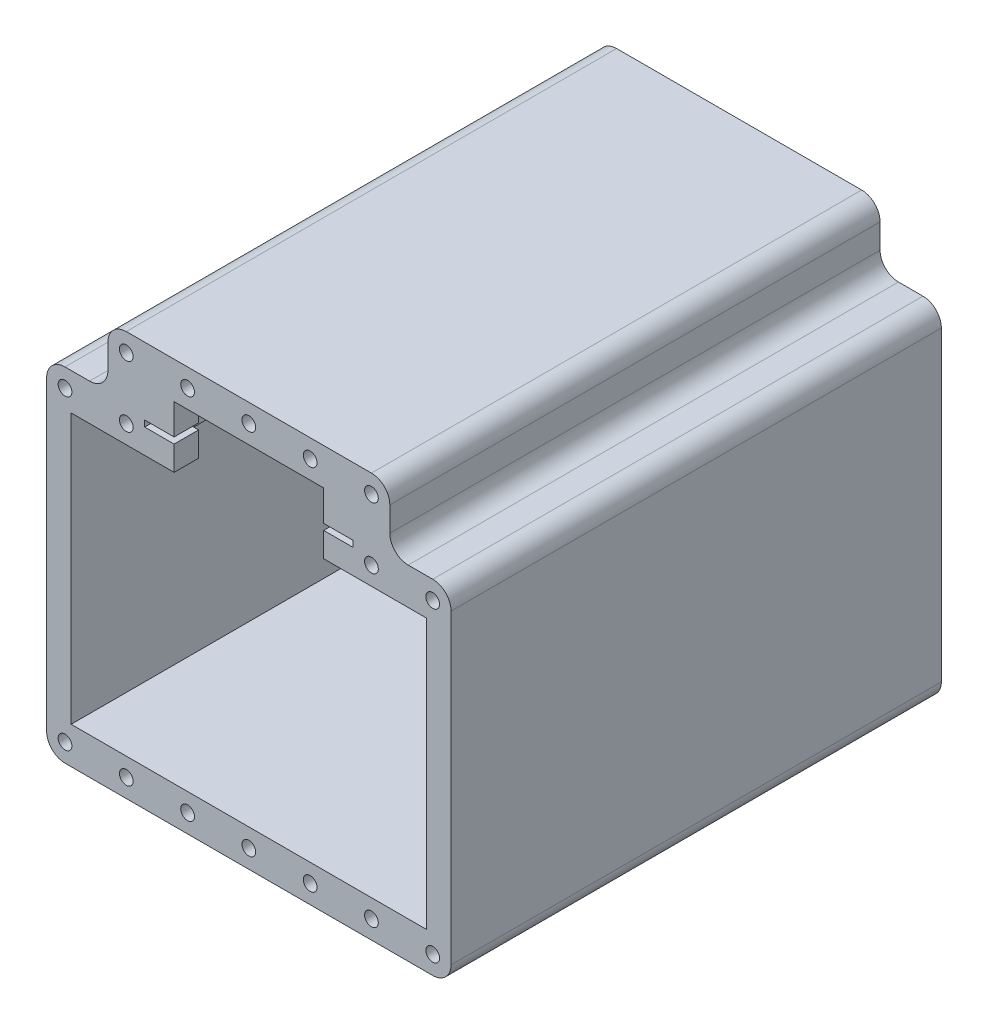
from build123d import *

# Parameters (mm, degrees)
BOSS_EXTRUDE1_DEPTH     = 200
CUT_EXTRUDE1_DEPTH      = 238.302549502
CUT_EXTRUDE1_DEPTH_BACK = 238.302549502
SKETCH2_R               = 2.8
SKETCH3_W               = 25
SKETCH3_H               = 200
BOSS_EXTRUDE2_DEPTH     = 25
SKETCH4_W               = 200
SKETCH4_H               = 2.5
CUT_EXTRUDE2_DEPTH      = 25
SKETCH5_W               = 200
SKETCH5_H               = 2.5
CUT_EXTRUDE3_DEPTH      = 25
CUT_EXTRUDE5_REACH      = 265.261
CUT_EXTRUDE7_REACH      = 251.862
SKETCH10_W              = 85
SKETCH10_H              = 35
SKETCH11_W              = 25
SKETCH11_H              = 15
BOSS_EXTRUDE3_DEPTH     = 25
CUT_EXTRUDE8_REACH      = 251.862
SKETCH12_W              = 85
SKETCH12_H              = 7.75


with BuildPart() as part:
    # Sketch1 → Boss-Extrude1 (new body)
    with BuildSketch(Plane.XY):
        with BuildLine():
            Line((-57.5, 60), (-57.5, 50))
            ThreePointArc((-57.5, 50), (-59.696699141, 44.696699141), (-65, 42.5))
            Line((-65, 42.5), (-75, 42.5))
            ThreePointArc((-75, 42.5), (-80.303300859, 40.303300859), (-82.5, 35))
            Line((-82.5, 35), (-82.5, -90))
            ThreePointArc((-82.5, -90), (-80.303300859, -95.303300859), (-75, -97.5))
            Line((-75, -97.5), (75, -97.5))
            ThreePointArc((75, -97.5), (80.303300859, -95.303300859), (82.5, -90))
            Line((82.5, -90), (82.5, 35))
            ThreePointArc((82.5, 35), (80.303300859, 40.303300859), (75, 42.5))
            Line((75, 42.5), (65, 42.5))
            ThreePointArc((65, 42.5), (59.696699141, 44.696699141), (57.5, 50))
            Line((57.5, 50), (57.5, 60))
            ThreePointArc((57.5, 60), (55.303300859, 65.303300859), (50, 67.5))
            Line((50, 67.5), (-50, 67.5))
            ThreePointArc((-50, 67.5), (-55.303300859, 65.303300859), (-57.5, 60))
        make_face()
        Polygon((-42.5, 52.5), (-42.5, 27.5), (-72.5, 27.5), (-72.5, -82.5), (72.5, -82.5), (72.5, 27.5), (42.5, 27.5), (42.5, 52.5), align=None, mode=Mode.SUBTRACT)
    extrude(amount=-BOSS_EXTRUDE1_DEPTH)

    # Sketch2 → Cut-Extrude1 (cut, two sides: drawn at the far end of the back side and taken through both)
    with BuildSketch(Plane.XY.offset(-CUT_EXTRUDE1_DEPTH_BACK)):
        with Locations((-75, 35)):
            Circle(SKETCH2_R)
        with Locations((-50, 35)):
            Circle(SKETCH2_R)
        with Locations((-50, 60)):
            Circle(SKETCH2_R)
        with Locations((50, 60)):
            Circle(SKETCH2_R)
        with Locations((25, 60)):
            Circle(SKETCH2_R)
        with Locations((0, 60)):
            Circle(SKETCH2_R)
        with Locations((-25, 60)):
            Circle(SKETCH2_R)
        with Locations((50, 35)):
            Circle(SKETCH2_R)
        with Locations((75, 35)):
            Circle(SKETCH2_R)
        with Locations((-75, -90)):
            Circle(SKETCH2_R)
        with Locations((-50, -90)):
            Circle(SKETCH2_R)
        with Locations((-25, -90)):
            Circle(SKETCH2_R)
        with Locations((0, -90)):
            Circle(SKETCH2_R)
        with Locations((25, -90)):
            Circle(SKETCH2_R)
        with Locations((50, -90)):
            Circle(SKETCH2_R)
        with Locations((75, -90)):
            Circle(SKETCH2_R)
    extrude(amount=CUT_EXTRUDE1_DEPTH + CUT_EXTRUDE1_DEPTH_BACK, mode=Mode.SUBTRACT)

    # Sketch3 → Boss-Extrude2 (add)
    with BuildSketch(Plane.XZ.offset(-52.5)):
        with Locations((-30, -100)):
            Rectangle(SKETCH3_W, SKETCH3_H)
        with Locations((30, -100)):
            Rectangle(SKETCH3_W, SKETCH3_H)
    extrude(amount=BOSS_EXTRUDE2_DEPTH)

    # Sketch4 → Cut-Extrude2 (cut)
    with BuildSketch(Plane(origin=(-17.5, 0, 0), x_dir=(0, 0, -1), z_dir=(1, 0, 0))):
        with Locations((100, 38.75)):
            Rectangle(SKETCH4_W, SKETCH4_H)
    extrude(amount=-CUT_EXTRUDE2_DEPTH, mode=Mode.SUBTRACT)

    # Sketch5 → Cut-Extrude3 (cut)
    with BuildSketch(Plane.ZY.offset(-17.5)):
        with Locations((-100, 38.75)):
            Rectangle(SKETCH5_W, SKETCH5_H)
    extrude(amount=-CUT_EXTRUDE3_DEPTH, mode=Mode.SUBTRACT)

    # Cut-Extrude5: up to this face of the body (flat: up to its plane)
    cut_extrude5_end = Plane(part.part.faces().sort_by_distance((-45, 27.5, -100))[0])
    # Sketch6 → Cut-Extrude5 (cut, up to the picked face)
    with BuildSketch(Plane.XZ.offset(-52.5), mode=Mode.PRIVATE) as cut_extrude5_sk1:
        Polygon((-30.5, 0), (-30.5, -10), (-42.5, -10), (-42.5, -60.8), (-42.5, -140), (-30.5, -140), (42.5, -140), (42.5, -60.8), (42.5, -10), (30.5, -10), (30.5, 0), (42.5, 0), (42.5, 1), (-42.5, 1), (-42.5, 0), align=None)
    cut_extrude5_tool1 = split(extrude(cut_extrude5_sk1.sketch, amount=CUT_EXTRUDE5_REACH, mode=Mode.PRIVATE), bisect_by=cut_extrude5_end, keep=Keep.BOTH, mode=Mode.PRIVATE)
    add(cut_extrude5_tool1.solids().sort_by(Axis((0, 52.5, -70.818008), (0, -1, 0)))[0], mode=Mode.SUBTRACT)

    # Cut-Extrude7: up to this face of the body (flat: up to its plane)
    cut_extrude7_end = Plane(part.part.faces().sort_by_distance((0, 52.5, -86.395348837))[0])
    # Sketch10 → Cut-Extrude7 (cut, up to the picked face)
    with BuildSketch(Plane.XZ.offset(-27.5), mode=Mode.PRIVATE) as cut_extrude7_sk1:
        with Locations((0, -182.5)):
            Rectangle(SKETCH10_W, SKETCH10_H)
    cut_extrude7_tool1 = split(extrude(cut_extrude7_sk1.sketch, amount=-CUT_EXTRUDE7_REACH, mode=Mode.PRIVATE), bisect_by=cut_extrude7_end, keep=Keep.BOTH, mode=Mode.PRIVATE)
    add(cut_extrude7_tool1.solids().sort_by(Axis((0, 27.5, -182.5), (0, 1, 0)))[0], mode=Mode.SUBTRACT)

    # Sketch11 → Boss-Extrude3 (add)
    with BuildSketch(Plane.XZ.offset(-27.5)):
        with Locations((-30, -157.5)):
            Rectangle(SKETCH11_W, SKETCH11_H)
        with Locations((30, -157.5)):
            Rectangle(SKETCH11_W, SKETCH11_H)
    extrude(amount=-BOSS_EXTRUDE3_DEPTH)

    # Cut-Extrude8: up to this face of the body (flat: up to its plane)
    cut_extrude8_end = Plane(part.part.faces().sort_by_distance((0, 52.5, -97.238878143))[0])
    # Sketch12 → Cut-Extrude8 (cut, up to the picked face)
    with BuildSketch(Plane.XZ.offset(-27.5), mode=Mode.PRIVATE) as cut_extrude8_sk1:
        with Locations((0, -143.875)):
            Rectangle(SKETCH12_W, SKETCH12_H)
    cut_extrude8_tool1 = split(extrude(cut_extrude8_sk1.sketch, amount=-CUT_EXTRUDE8_REACH, mode=Mode.PRIVATE), bisect_by=cut_extrude8_end, keep=Keep.BOTH, mode=Mode.PRIVATE)
    add(cut_extrude8_tool1.solids().sort_by(Axis((0, 27.5, -143.875), (0, 1, 0)))[0], mode=Mode.SUBTRACT)


solid = part.part
